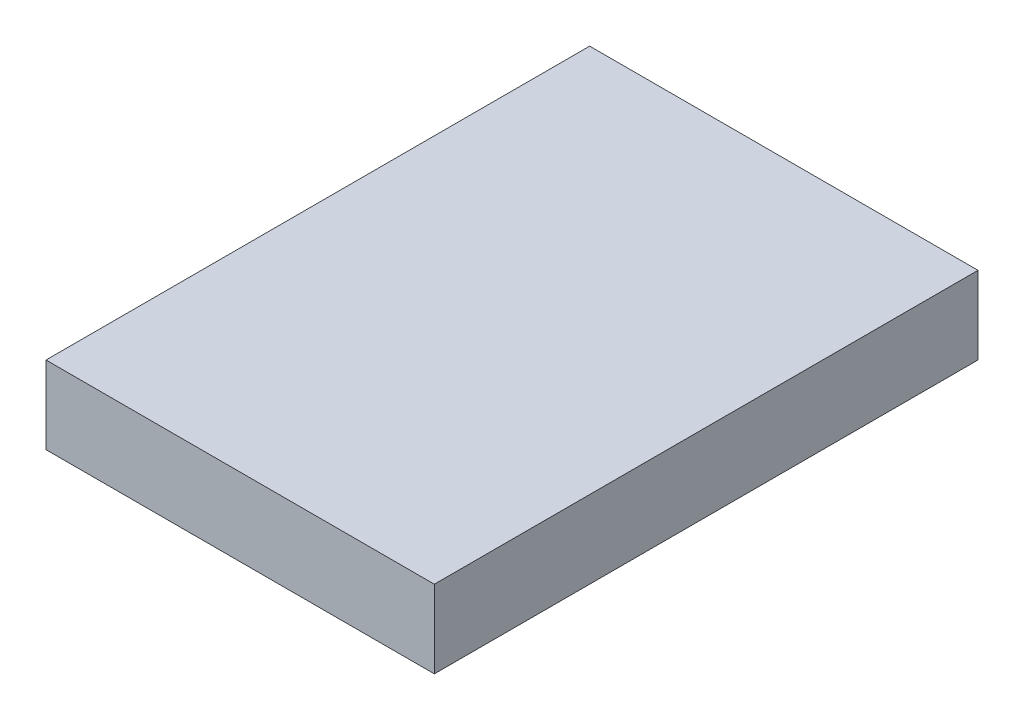
from build123d import *

# Parameters (mm, degrees)
SKETCH_1_W      = 30
SKETCH_1_H      = 42
EXTRUDE_1_DEPTH = 6


with BuildPart() as part:
    # 草图1 → 凸台-拉伸1 (new body)
    with BuildSketch(Plane(origin=(0, 0, 0), x_dir=(1, 0, 0), z_dir=(0, 1, 0))):
        Rectangle(SKETCH_1_W, SKETCH_1_H)
    extrude(amount=EXTRUDE_1_DEPTH)


solid = part.part
